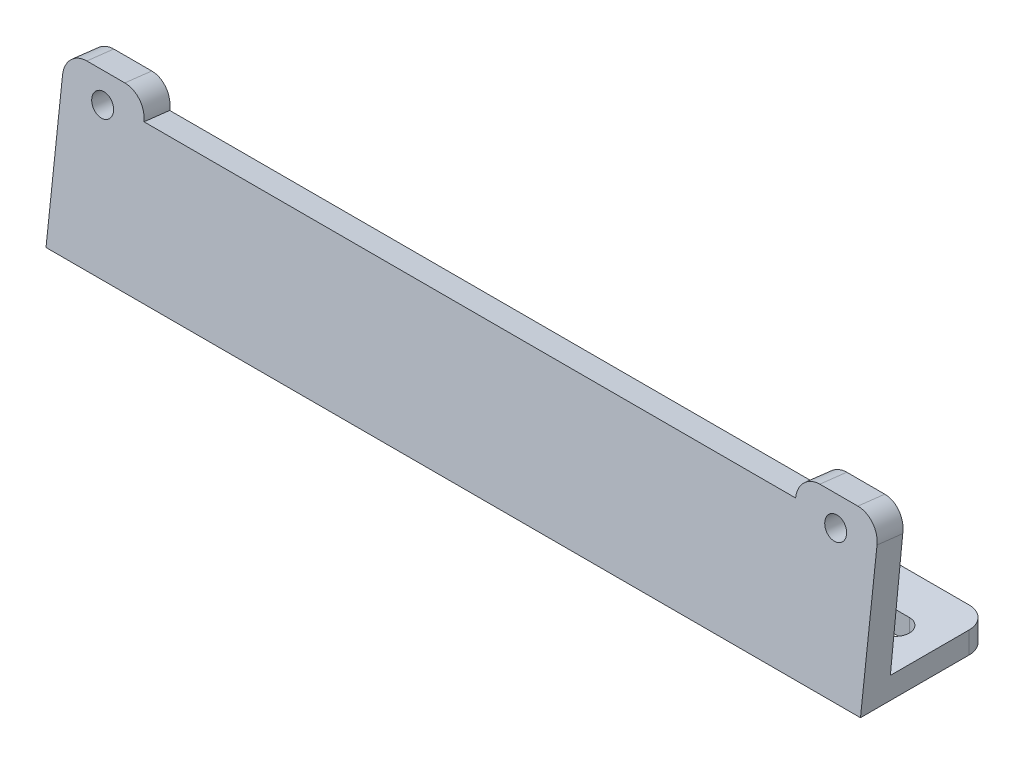
from build123d import *

# Parameters (mm, degrees)
SKETCH1_W           = 150
SKETCH1_H           = 20
BOSS_EXTRUDE1_DEPTH = 4
BOSS_EXTRUDE3_DEPTH = 150
FILLET1_R           = 4
SKETCH4_W           = 120
SKETCH4_H           = 25.205319461
CUT_EXTRUDE1_DEPTH  = 10
FILLET2_R           = 4
FILLET3_R           = 4
SKETCH6_W           = 124
SKETCH6_H           = 7.02135472
BOSS_EXTRUDE4_DEPTH = 4
BOSS_EXTRUDE5_START = -150
BOSS_EXTRUDE5_DEPTH = 150
SKETCH5_R           = 2.005
CUT_EXTRUDE2_DEPTH  = 10


with BuildPart() as part:
    # Sketch1 → Boss-Extrude1 (new body)
    with BuildSketch(Plane(origin=(0, 0, 0), x_dir=(1, 0, 0), z_dir=(0, 1, 0))):
        Rectangle(SKETCH1_W, SKETCH1_H)
        with BuildLine():
            Line((-67.5, 2.5), (-62.5, 2.5))
            ThreePointArc((-62.5, 2.5), (-60, 0), (-62.5, -2.5))
            Line((-62.5, -2.5), (-67.5, -2.5))
            ThreePointArc((-67.5, -2.5), (-70, 0), (-67.5, 2.5))
        make_face(mode=Mode.SUBTRACT)
        with BuildLine():
            Line((62.5, 2.5), (67.5, 2.5))
            ThreePointArc((67.5, 2.5), (70, 0), (67.5, -2.5))
            Line((67.5, -2.5), (62.5, -2.5))
            ThreePointArc((62.5, -2.5), (60, 0), (62.5, 2.5))
        make_face(mode=Mode.SUBTRACT)
    extrude(amount=BOSS_EXTRUDE1_DEPTH)

    # Sketch3 → Boss-Extrude3 (add)
    with BuildSketch(Plane(origin=(75, 0, 0), x_dir=(0, 0, -1), z_dir=(1, 0, 0))):
        Polygon((-10, 0), (-14, 0), (-10.484132576, 30), (-5.518119877, 29.418005257), (-10, 4), align=None)
    extrude(amount=-BOSS_EXTRUDE3_DEPTH)

    # Fillet1
    fillet1_edges = [part.edges().sort_by_distance(p)[0] for p in [
        (75, 29.709002629, 8.001126226),
        (-75, 29.709002629, 8.001126226),
    ]]
    fillet(fillet1_edges, radius=FILLET1_R)

    # Sketch4 → Cut-Extrude1 (cut)
    with BuildSketch(Plane(origin=(0, 1.618508238, 13.810317987), x_dir=(1, 0, 0), z_dir=(0, 0.11639894850026859, 0.9932025396604823))):
        with Locations((0, 15.973074452)):
            Rectangle(SKETCH4_W, SKETCH4_H)
    extrude(amount=-CUT_EXTRUDE1_DEPTH, mode=Mode.SUBTRACT)

    # Fillet2
    fillet2_edges = [part.edges().sort_by_distance(p)[0] for p in [
        (-60, 29.709002629, 8.001126226),
        (60, 29.709002629, 8.001126226),
    ]]
    fillet(fillet2_edges, radius=FILLET2_R)

    # Fillet3
    fillet3_edges = [part.edges().sort_by_distance(p)[0] for p in [
        (-75, 2, -10),
        (75, 2, -10),
    ]]
    fillet(fillet3_edges, radius=FILLET3_R)

    # Sketch6 → Boss-Extrude4 (add)
    with BuildSketch(Plane(origin=(0, 4, 0), x_dir=(1, 0, 0), z_dir=(0, 1, 0))):
        with Locations((2, -6.973455216)):
            Rectangle(SKETCH6_W, SKETCH6_H)
    extrude(amount=-BOSS_EXTRUDE4_DEPTH)

    # Sketch8 → Boss-Extrude5 (add)
    with BuildSketch(Plane(origin=(75, 0, 0), x_dir=(0, 0, -1), z_dir=(1, 0, 0)).offset(BOSS_EXTRUDE5_START)):
        Polygon((-6.213877267, 25.472169021), (-8.496997767, 4), (-13.531217677, 4), (-10.94972837, 26.027189841), align=None)
    extrude(amount=BOSS_EXTRUDE5_DEPTH)

    # Sketch5 → Cut-Extrude2 (cut)
    with BuildSketch(Plane(origin=(0, 1.618508238, 13.810317987), x_dir=(1, 0, 0), z_dir=(0, 0.11639894850026859, 0.9932025396604823))):
        with Locations(Location((-67.5, 23.575734182, 0), (0, 0, 270))):
            Circle(SKETCH5_R)
        with Locations(Location((67.5, 23.575734182, 0), (0, 0, 270))):
            Circle(SKETCH5_R)
    extrude(amount=-CUT_EXTRUDE2_DEPTH, mode=Mode.SUBTRACT)


solid = part.part
